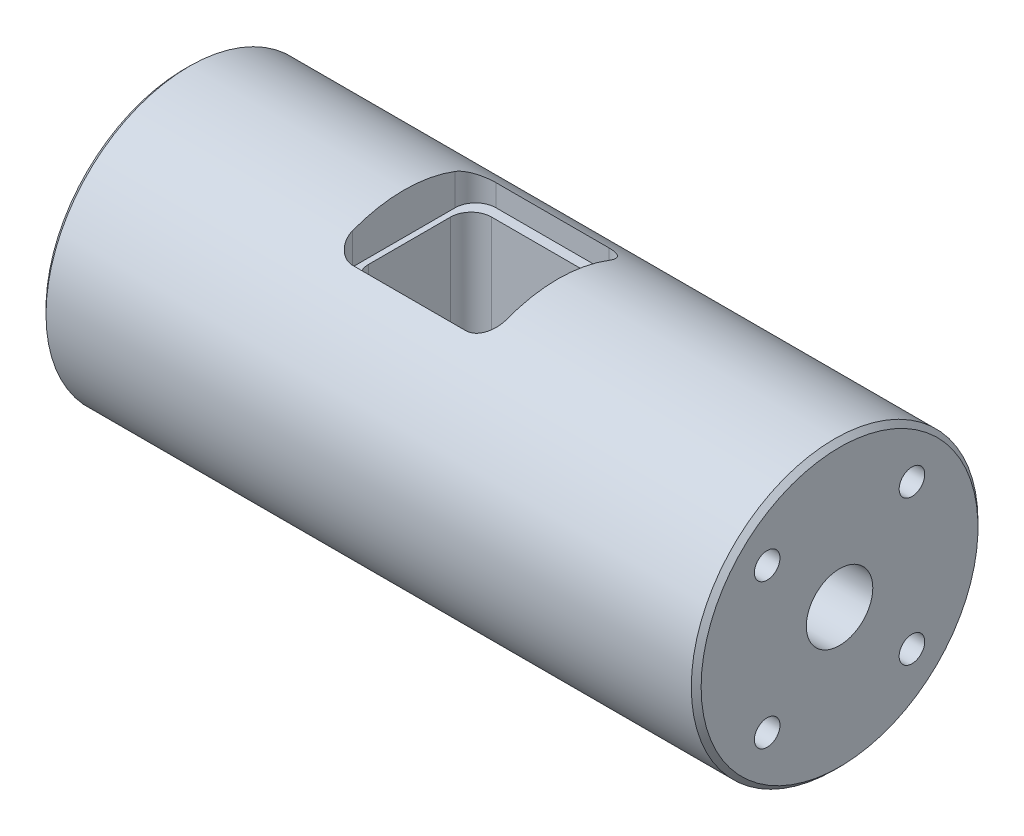
from build123d import *

# Parameters (mm, degrees)
SKETCH1_W                   = 203.2
SKETCH1_H                   = 44.4627
CHAMFER1_SIZE               = 1.524
CUT_EXTRUDE2_START          = -88.9254
SKETCH2_W                   = 44.45
SKETCH2_H                   = 38.1
CUT_EXTRUDE2_DEPTH          = 177.8508
FILLET1_R                   = 6.35
CUT_EXTRUDE4_START          = 31.7627
SKETCH3_W                   = 47.752
SKETCH3_H                   = 44.45
CUT_EXTRUDE4_DEPTH          = 88.9254
FILLET2_R                   = 6.35
CUT_EXTRUDE6_START          = -101.6
SKETCH4_R                   = 18.0578125
CUT_EXTRUDE6_DEPTH          = 63.5
CUT_EXTRUDE8_START          = 101.6
SKETCH5_R                   = 6.7437
CUT_EXTRUDE8_DEPTH          = 95.25
CUT_EXTRUDE10_START         = 101.6
SKETCH6_R                   = 10.3124
CUT_EXTRUDE10_DEPTH         = 31.75
F_3_8_16_TAPPED_HOLE2_D     = 7.9375
F_3_8_16_TAPPED_HOLE2_DEPTH = 22.352
F_3_8_16_TAPPED_HOLE2_TIP   = 2.384665582


with BuildPart() as part:
    # Sketch1 → Revolve1 (revolve)
    with BuildSketch(Plane(origin=(0, 0, 0), x_dir=(1, 0, 0), z_dir=(0, 1, 0)), mode=Mode.PRIVATE) as revolve1_sk:
        with Locations((0, 22.23135)):
            Rectangle(SKETCH1_W, SKETCH1_H)
    revolve(revolve1_sk.sketch.rotate(Axis((-127, 0, 0), (1, 0, 0)), 180), axis=Axis((-127, 0, 0), (1, 0, 0)))

    # Chamfer1
    chamfer1_edges = [part.edges().sort_by_distance(p)[0] for p in [
        (101.6, 0, -44.4627),
        (-101.6, 0, -44.4627),
    ]]
    chamfer(chamfer1_edges, length=CHAMFER1_SIZE)

    # Sketch2 → Cut-Extrude2 (cut)
    with BuildSketch(Plane(origin=(0, 0, 0), x_dir=(1, 0, 0), z_dir=(0, 1, 0)).offset(CUT_EXTRUDE2_START)):
        with Locations((-9.525, 0)):
            Rectangle(SKETCH2_W, SKETCH2_H)
    extrude(amount=CUT_EXTRUDE2_DEPTH, mode=Mode.SUBTRACT)

    # Fillet1
    fillet1_edges = [part.edges().sort_by_distance(p)[0] for p in [
        (-31.75, 0, -19.05),
        (-31.75, 0, 19.05),
        (12.7, 0, 19.05),
        (12.7, 0, -19.05),
    ]]
    fillet(fillet1_edges, radius=FILLET1_R)

    # Sketch3 → Cut-Extrude4 (cut)
    with BuildSketch(Plane(origin=(0, 0, 0), x_dir=(1, 0, 0), z_dir=(0, 1, 0)).offset(CUT_EXTRUDE4_START)):
        with Locations((-9.652, 0)):
            Rectangle(SKETCH3_W, SKETCH3_H)
    extrude(amount=CUT_EXTRUDE4_DEPTH, mode=Mode.SUBTRACT)

    # Fillet2
    fillet2_edges = [part.edges().sort_by_distance(p)[0] for p in [
        (-33.528, 35.136096599, -22.225),
        (-33.528, 35.136096599, 22.225),
        (14.224, 35.136096599, 22.225),
        (14.224, 35.136096599, -22.225),
    ]]
    fillet(fillet2_edges, radius=FILLET2_R)

    # Sketch4 → Cut-Extrude6 (cut)
    with BuildSketch(Plane(origin=(0, 0, 0), x_dir=(0, 0, -1), z_dir=(1, 0, 0)).offset(CUT_EXTRUDE6_START)):
        Circle(SKETCH4_R)
    extrude(amount=CUT_EXTRUDE6_DEPTH, mode=Mode.SUBTRACT)

    # Sketch5 → Cut-Extrude8 (cut)
    with BuildSketch(Plane(origin=(0, 0, 0), x_dir=(0, 0, -1), z_dir=(1, 0, 0)).offset(CUT_EXTRUDE8_START)):
        Circle(SKETCH5_R)
    extrude(amount=-CUT_EXTRUDE8_DEPTH, mode=Mode.SUBTRACT)

    # Sketch6 → Cut-Extrude10 (cut)
    with BuildSketch(Plane(origin=(0, 0, 0), x_dir=(0, 0, -1), z_dir=(1, 0, 0)).offset(CUT_EXTRUDE10_START)):
        Circle(SKETCH6_R)
    extrude(amount=-CUT_EXTRUDE10_DEPTH, mode=Mode.SUBTRACT)

    # 3/8-16 Tapped Hole2
    with Locations(Plane(origin=(101.6, 0, 0), x_dir=(0, 0, -1), z_dir=(1, 0, 0))):
        with Locations((-22.4536, -22.4536), (22.4536, -22.4536), (-22.4536, 22.4536), (22.4536, 22.4536)):
            Hole(F_3_8_16_TAPPED_HOLE2_D / 2, depth=F_3_8_16_TAPPED_HOLE2_DEPTH)
            with Locations((0, 0, -(F_3_8_16_TAPPED_HOLE2_DEPTH + F_3_8_16_TAPPED_HOLE2_TIP / 2))):  # 118° drill point
                Cone(0, F_3_8_16_TAPPED_HOLE2_D / 2, F_3_8_16_TAPPED_HOLE2_TIP, mode=Mode.SUBTRACT)


solid = part.part
